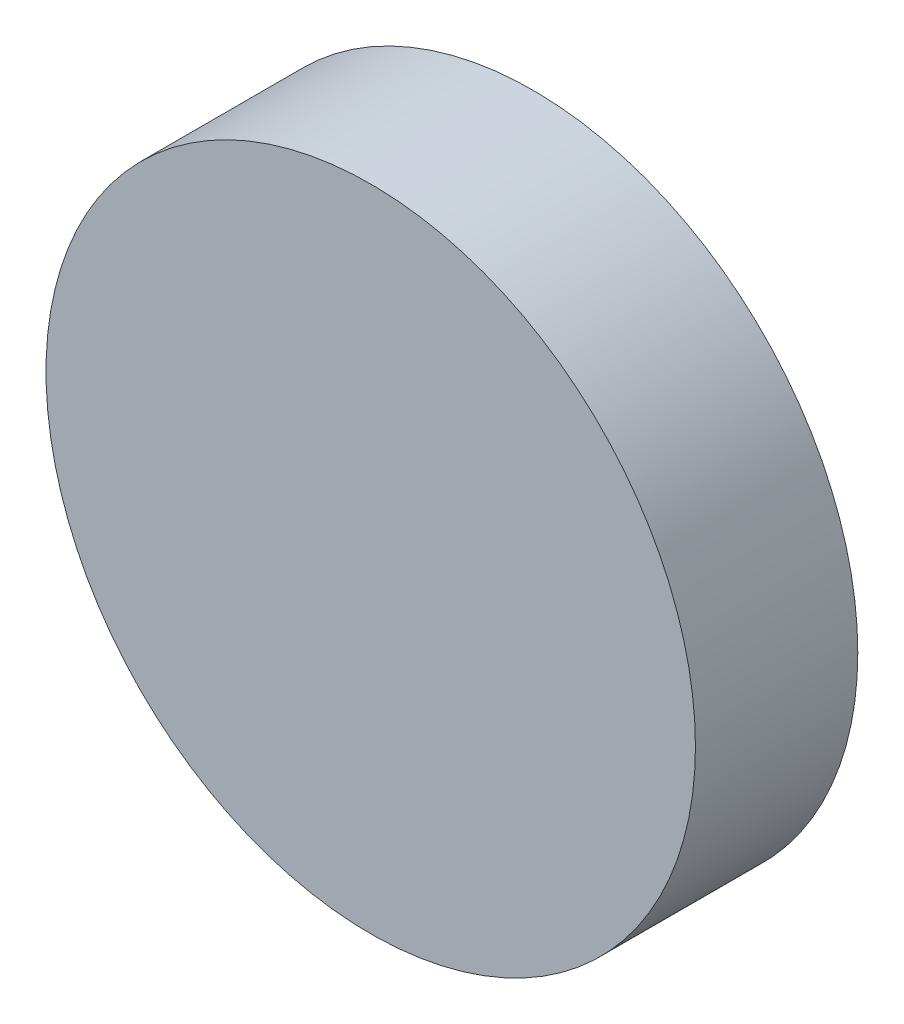
from build123d import *

# Parameters (mm, degrees)
SKETCH_1_R      = 50
EXTRUDE_1_DEPTH = 25


with BuildPart() as part:
    # 草图1 → 凸台-拉伸1 (new body)
    with BuildSketch(Plane.XY):
        Circle(SKETCH_1_R)
    extrude(amount=EXTRUDE_1_DEPTH)


solid = part.part
